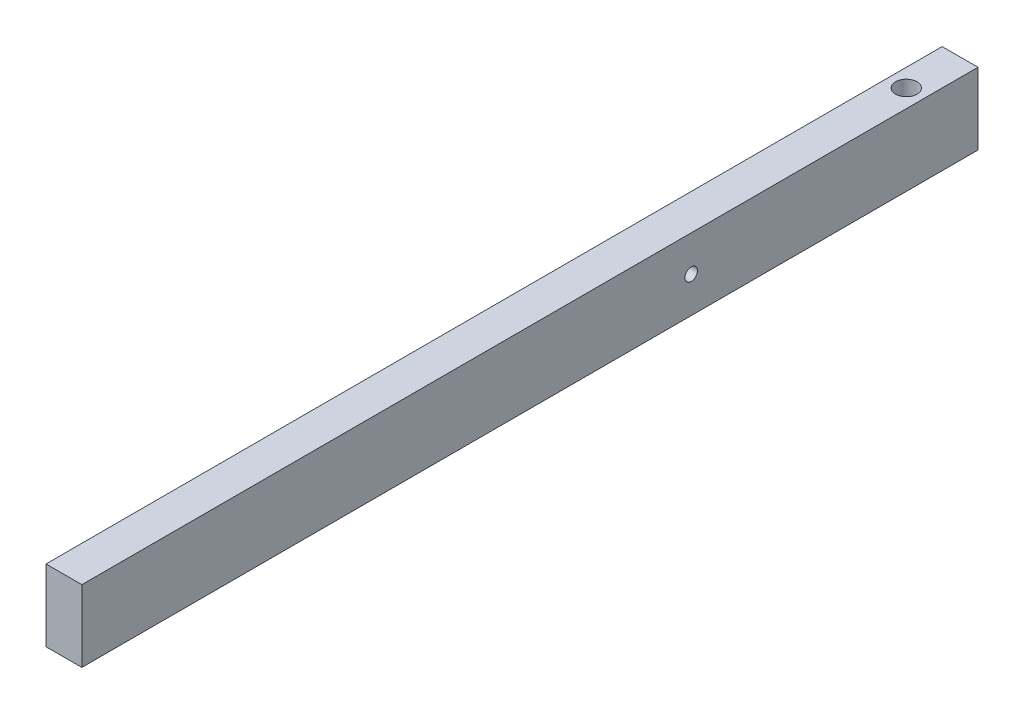
from build123d import *

# Parameters (mm, degrees)
SKETCH_2_W          = 20
SKETCH_2_H          = 40
EXTRUDE_6_DEPTH     = 500
SKETCH_3_R          = 6
CUT_EXTRUDE_1_DEPTH = 502.697119784
SKETCH_5_R          = 3.5
CUT_EXTRUDE_2_DEPTH = 501.799361022


with BuildPart() as part:
    # Эскиз2 → Бобышка-Вытянуть6 (new body)
    with BuildSketch(Plane.XY):
        Rectangle(SKETCH_2_W, SKETCH_2_H)
    extrude(amount=EXTRUDE_6_DEPTH)

    # Эскиз3 → Вырез-Вытянуть1 (cut, through all)
    with BuildSketch(Plane(origin=(0, 20, 0), x_dir=(1, 0, 0), z_dir=(0, 1, 0))):
        with Locations(Location((0, -30, 0), (0, 0, 270))):
            Circle(SKETCH_3_R)
    extrude(amount=-CUT_EXTRUDE_1_DEPTH, mode=Mode.SUBTRACT)

    # Эскиз5 → Вырез-Вытянуть2 (cut, through all)
    with BuildSketch(Plane.ZY.offset(10)):
        with Locations(Location((160, 0, 0), (0, 0, 270))):
            Circle(SKETCH_5_R)
    extrude(amount=-CUT_EXTRUDE_2_DEPTH, mode=Mode.SUBTRACT)


solid = part.part
